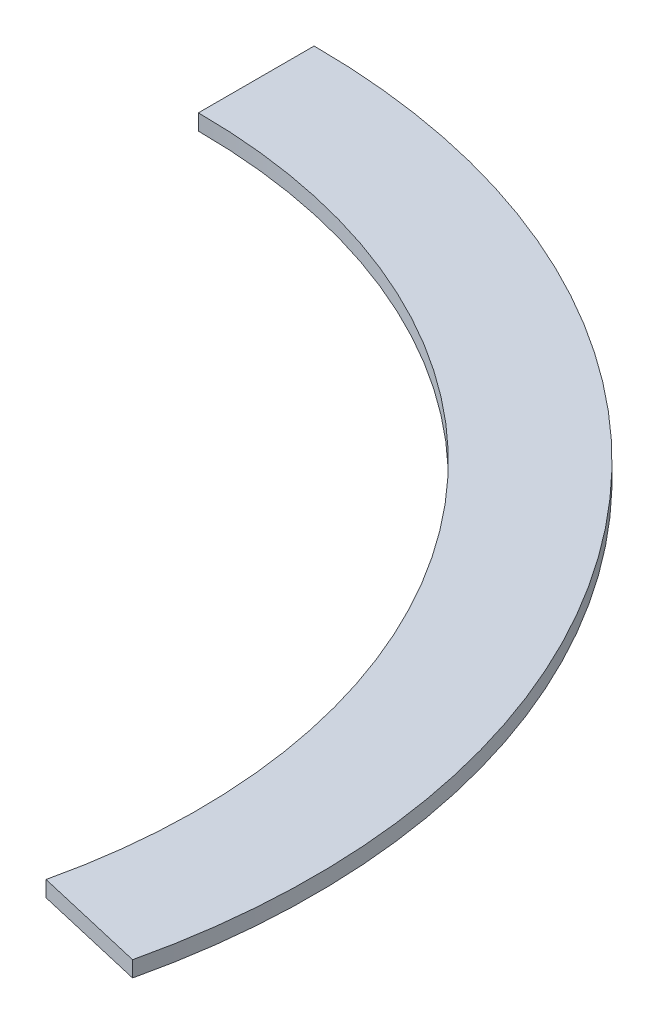
from build123d import *

# Parameters (mm, degrees)
BOSS_EXTRUDE1_DEPTH = 1


with BuildPart() as part:
    # Sketch1 → Boss-Extrude1 (new body)
    with BuildSketch(Plane(origin=(0, 0, 0), x_dir=(1, 0, 0), z_dir=(0, 1, 0))):
        with BuildLine():
            Line((0, 38.091872526), (0, 45.397824667))
            ThreePointArc((0, 45.397824667), (35.550557818, 28.233319382), (44.218429426, -10.280709291))
            Line((44.218429426, -10.280709291), (37.102279487, -8.6262164))
            ThreePointArc((37.102279487, -8.6262164), (29.829343674, 23.689681478), (0, 38.091872526))
        make_face()
    extrude(amount=BOSS_EXTRUDE1_DEPTH)


solid = part.part
